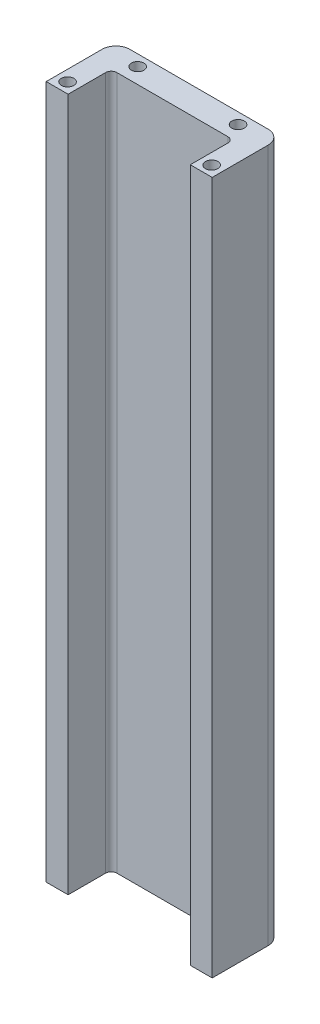
from build123d import *

# Parameters (mm, degrees)
SKETCH2_R           = 2.25
BOSS_EXTRUDE1_DEPTH = 250


with BuildPart() as part:
    # Sketch2 → Boss-Extrude1 (new body)
    with BuildSketch(Plane(origin=(0, 0, 0), x_dir=(1, 0, 0), z_dir=(0, 1, 0))):
        with BuildLine():
            Line((-22.025, -12.575), (-22.025, 0.975))
            ThreePointArc((-22.025, 0.975), (-21.439213562, 2.389213562), (-20.025, 2.975))
            Line((-20.025, 2.975), (20.025, 2.975))
            ThreePointArc((20.025, 2.975), (21.439213562, 2.389213562), (22.025, 0.975))
            Line((22.025, 0.975), (22.025, -12.575))
            Line((22.025, -12.575), (29.925, -12.575))
            Line((29.925, -12.575), (29.925, 7.575))
            ThreePointArc((29.925, 7.575), (28.460533906, 11.110533906), (24.925, 12.575))
            Line((24.925, 12.575), (-24.925, 12.575))
            ThreePointArc((-24.925, 12.575), (-28.460533906, 11.110533906), (-29.925, 7.575))
            Line((-29.925, 7.575), (-29.925, -12.575))
            Line((-29.925, -12.575), (-22.025, -12.575))
        make_face()
        with Locations(Location((18.1, 8.575, 0), (0, 0, 270))):
            Circle(SKETCH2_R, mode=Mode.SUBTRACT)
        with Locations(Location((25.975, -8.825, 0), (0, 0, 270))):
            Circle(SKETCH2_R, mode=Mode.SUBTRACT)
        with Locations(Location((-25.975, -8.825, 0), (0, 0, 90))):
            Circle(SKETCH2_R, mode=Mode.SUBTRACT)
        with Locations(Location((-18.1, 8.575, 0), (0, 0, 90))):
            Circle(SKETCH2_R, mode=Mode.SUBTRACT)
    extrude(amount=-BOSS_EXTRUDE1_DEPTH)


solid = part.part
